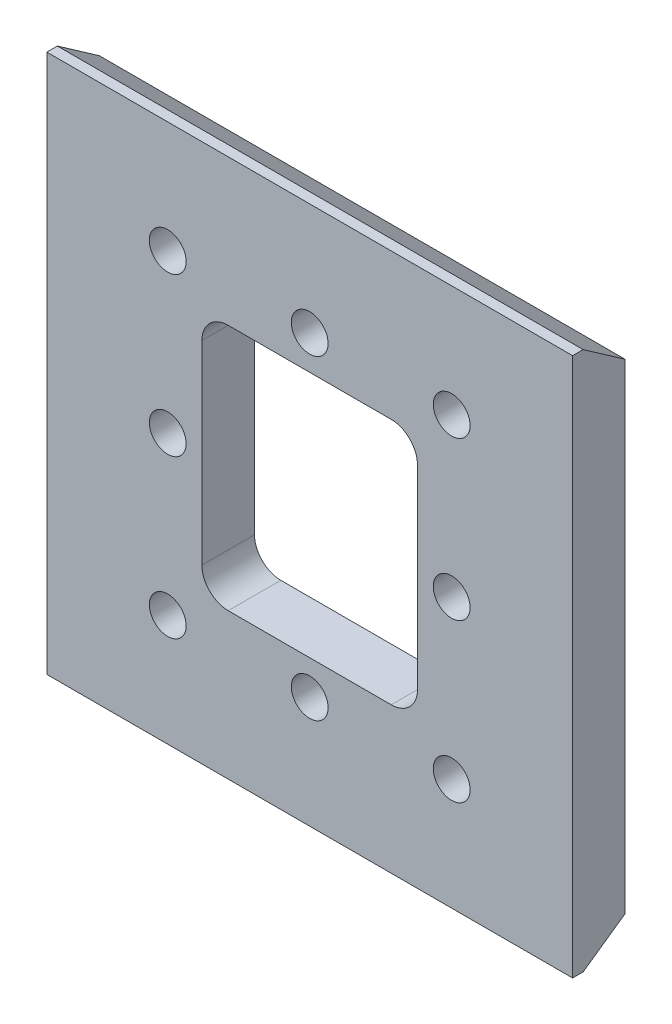
from build123d import *

# Parameters (mm, degrees)
SKETCH_1_W          = 200
SKETCH_1_H          = 205
EXTRUDE_1_DEPTH     = 20
SKETCH_2_R          = 7
CUT_EXTRUDE_1_DEPTH = 145.589937409
CUT_EXTRUDE_2_DEPTH = 226.624134347


with BuildPart() as part:
    # 草图1 → 凸台-拉伸1 (new body)
    with BuildSketch(Plane.XY):
        Rectangle(SKETCH_1_W, SKETCH_1_H)
    extrude(amount=EXTRUDE_1_DEPTH)

    # 草图2 → 切除-拉伸1 (cut, through all)
    with BuildSketch(Plane.XY.offset(20)):
        with Locations((-54, 60)):
            Circle(SKETCH_2_R)
        with Locations((0, 60)):
            Circle(SKETCH_2_R)
        with Locations((-54, 0)):
            Circle(SKETCH_2_R)
        with Locations(Location((54, 0, 0), (0, 0, 180))):
            Circle(SKETCH_2_R)
        with Locations(Location((54, 60, 0), (0, 0, 180))):
            Circle(SKETCH_2_R)
        with Locations(Location((-54, -60, 0), (0, 0, 180))):
            Circle(SKETCH_2_R)
        with Locations(Location((0, -60, 0), (0, 0, 180))):
            Circle(SKETCH_2_R)
        with Locations((54, -60)):
            Circle(SKETCH_2_R)
        with BuildLine():
            Line((-31, 47), (31, 47))
            ThreePointArc((31, 47), (38.071067812, 44.071067812), (41, 37))
            Line((41, 37), (41, -37))
            ThreePointArc((41, -37), (38.071067812, -44.071067812), (31, -47))
            Line((31, -47), (-31, -47))
            ThreePointArc((-31, -47), (-38.071067812, -44.071067812), (-41, -37))
            Line((-41, -37), (-41, 37))
            ThreePointArc((-41, 37), (-38.071067812, 44.071067812), (-31, 47))
        make_face()
    extrude(amount=-CUT_EXTRUDE_1_DEPTH, mode=Mode.SUBTRACT)

    # 草图3 → 切除-拉伸2 (cut, through all)
    with BuildSketch(Plane.ZY.offset(100)):
        Polygon((0, 102.5), (0, 91.296679389), (16, 102.5), align=None)
        Polygon((0, -102.5), (16, -102.5), (0, -91.296679389), align=None)
    extrude(amount=-CUT_EXTRUDE_2_DEPTH, mode=Mode.SUBTRACT)


solid = part.part
